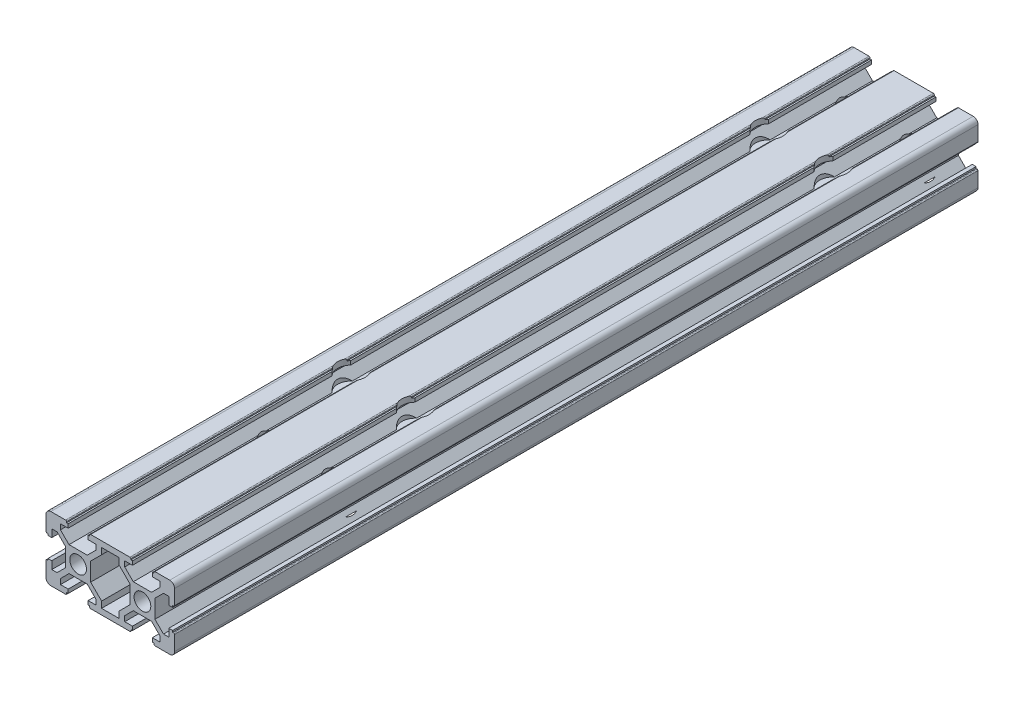
from build123d import *

# Parameters (mm, degrees)
SKETCH_1_R               = 2.6
EXTRUDE_1_DEPTH          = 125
FILLET_1_R               = 1.5
FILLET_2_R               = 0.3
CUT_EXTRUDE_1_DEPTH      = 128.350736158
CUT_EXTRUDE_1_DEPTH_BACK = 128.350736158
SKETCH_3_R               = 2.1
SKETCH_3_R_2             = 3.1
SKETCH_4_R               = 4.25
CUT_EXTRUDE_2_DEPTH      = 128.350736256
SKETCH_5_R               = 5.25
CUT_EXTRUDE_3_DEPTH      = 128.350736267


with BuildPart() as part:
    # 草图1 → 凸台-拉伸1 (new, symmetric)
    with BuildSketch(Plane.XY):
        Polygon((-13.9, 0), (-13.9, 2.839339828), (-16.560660172, 5.5), (-18.2, 5.5), (-18.2, 3.1), (-19.4, 3.1), (-19.4, 3.6), (-20, 3.6), (-20, 10), (-13.6, 10), (-13.6, 9.4), (-13.1, 9.4), (-13.1, 8.2), (-15.5, 8.2), (-15.5, 6.560660172), (-12.839339828, 3.9), (-7.160660172, 3.9), (-4.5, 6.560660172), (-4.5, 8.2), (-6.9, 8.2), (-6.9, 9.4), (-6.4, 9.4), (-6.4, 10), (6.4, 10), (6.4, 9.4), (6.9, 9.4), (6.9, 8.2), (4.5, 8.2), (4.5, 6.560660172), (7.160660172, 3.9), (12.839339828, 3.9), (15.5, 6.560660172), (15.5, 8.2), (13.1, 8.2), (13.1, 9.4), (13.6, 9.4), (13.6, 10), (20, 10), (20, 3.6), (19.4, 3.6), (19.4, 3.1), (18.2, 3.1), (18.2, 5.5), (16.560660172, 5.5), (13.9, 2.839339828), (13.9, 0), (13.9, -2.839339828), (16.560660172, -5.5), (18.2, -5.5), (18.2, -3.1), (19.4, -3.1), (19.4, -3.6), (20, -3.6), (20, -10), (13.6, -10), (13.6, -9.4), (13.1, -9.4), (13.1, -8.2), (15.5, -8.2), (15.5, -6.560660172), (12.839339828, -3.9), (7.160660172, -3.9), (4.5, -6.560660172), (4.5, -8.2), (6.9, -8.2), (6.9, -9.4), (6.4, -9.4), (6.4, -10), (-6.4, -10), (-6.4, -9.4), (-6.9, -9.4), (-6.9, -8.2), (-4.5, -8.2), (-4.5, -6.560660172), (-7.160660172, -3.9), (-12.839339828, -3.9), (-15.5, -6.560660172), (-15.5, -8.2), (-13.1, -8.2), (-13.1, -9.4), (-13.6, -9.4), (-13.6, -10), (-20, -10), (-20, -3.6), (-19.4, -3.6), (-19.4, -3.1), (-18.2, -3.1), (-18.2, -5.5), (-16.560660172, -5.5), (-13.9, -2.839339828), align=None)
        with Locations((-10, 0)):
            Circle(SKETCH_1_R, mode=Mode.SUBTRACT)
        with Locations(Location((10, 0, 0), (0, 0, 180))):
            Circle(SKETCH_1_R, mode=Mode.SUBTRACT)
        Polygon((-6.1, -2.839339828), (-6.1, 2.839339828), (-2.7, 6.239339828), (-2.7, 8.2), (2.7, 8.2), (2.7, 6.239339828), (6.1, 2.839339828), (6.1, -2.839339828), (2.7, -6.239339828), (2.7, -8.2), (-2.7, -8.2), (-2.7, -6.239339828), align=None, mode=Mode.SUBTRACT)
    extrude(amount=EXTRUDE_1_DEPTH, both=True)

    # 圆角1
    fillet_1_edges = [part.edges().sort_by_distance(p)[0] for p in [
        (-20, 10, 0),
        (20, 10, 0),
        (20, -10, 0),
        (-20, -10, 0),
    ]]
    fillet(fillet_1_edges, radius=FILLET_1_R)

    # 圆角2
    fillet_2_edges = [part.edges().sort_by_distance(p)[0] for p in [
        (-20, 3.6, 0),
        (-13.6, 10, 0),
        (-6.4, 10, 0),
        (6.4, 10, 0),
        (13.6, 10, 0),
        (20, 3.6, 0),
        (20, -3.6, 0),
        (13.6, -10, 0),
        (6.4, -10, 0),
        (-6.4, -10, 0),
        (-13.6, -10, 0),
        (-20, -3.6, 0),
    ]]
    fillet(fillet_2_edges, radius=FILLET_2_R)

    # 草图3 → 切除-拉伸1 (cut, two sides: drawn at the far end of the back side and taken through both)
    with BuildSketch(Plane.XZ.offset(3.9).offset(-CUT_EXTRUDE_1_DEPTH_BACK)):
        with Locations(Location((-10, -90, 0), (0, 0, 270))):
            Circle(SKETCH_3_R)
        with Locations(Location((10, -90, 0), (0, 0, 270))):
            Circle(SKETCH_3_R)
        with Locations(Location((10, 40, 0), (0, 0, 270))):
            Circle(SKETCH_3_R)
        with Locations(Location((-10, 40, 0), (0, 0, 270))):
            Circle(SKETCH_3_R)
        with Locations(Location((-10, -45, 0), (0, 0, 270))):
            Circle(SKETCH_3_R)
        with Locations(Location((10, -45, 0), (0, 0, 270))):
            Circle(SKETCH_3_R)
        with Locations(Location((10, -5, 0), (0, 0, 270))):
            Circle(SKETCH_3_R)
        with Locations(Location((-10, -5, 0), (0, 0, 270))):
            Circle(SKETCH_3_R)
        with Locations(Location((10, -115, 0), (0, 0, 203.663841572))):
            Circle(SKETCH_3_R_2)
        with Locations(Location((-10, -115, 0), (0, 0, 336.336158428))):
            Circle(SKETCH_3_R_2)
        with Locations(Location((10, 65, 0), (0, 0, 203.663841572))):
            Circle(SKETCH_3_R_2)
        with Locations(Location((-10, 65, 0), (0, 0, 336.336158428))):
            Circle(SKETCH_3_R_2)
    extrude(amount=CUT_EXTRUDE_1_DEPTH + CUT_EXTRUDE_1_DEPTH_BACK, mode=Mode.SUBTRACT)

    # 草图4 → 切除-拉伸2 (cut, through all)
    with BuildSketch(Plane(origin=(0, 3.9, 0), x_dir=(1, 0, 0), z_dir=(0, 1, 0))):
        with Locations((-10, -40)):
            Circle(SKETCH_4_R)
        with Locations((10, -40)):
            Circle(SKETCH_4_R)
        with Locations((-10, 90)):
            Circle(SKETCH_4_R)
        with Locations((10, 90)):
            Circle(SKETCH_4_R)
    extrude(amount=CUT_EXTRUDE_2_DEPTH, mode=Mode.SUBTRACT)

    # 草图5 → 切除-拉伸3 (cut, through all)
    with BuildSketch(Plane.XZ.offset(3.9)):
        with Locations((10, -115)):
            Circle(SKETCH_5_R)
        with Locations((-10, -115)):
            Circle(SKETCH_5_R)
        with Locations((10, 65)):
            Circle(SKETCH_5_R)
        with Locations((-10, 65)):
            Circle(SKETCH_5_R)
    extrude(amount=CUT_EXTRUDE_3_DEPTH, mode=Mode.SUBTRACT)


solid = part.part
